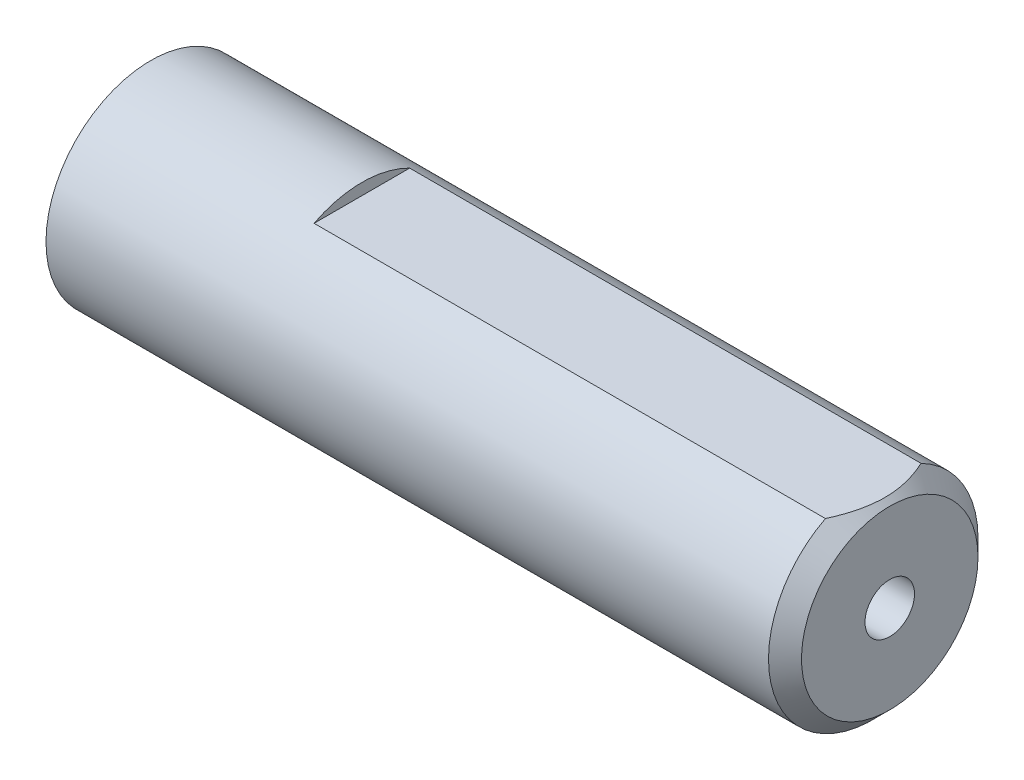
from build123d import *

# Parameters (mm, degrees)
ESBO_O1_R                = 3.175
RESSALTO_EXTRUS_O1_DEPTH = 22.4
CHANFRO1_SIZE            = 0.5
ESBO_O3_W                = 2.89827535
ESBO_O3_H                = 0.35
CORTE_EXTRUS_O1_DEPTH    = 16
ESBO_O4_R                = 0.75
CORTE_EXTRUS_O2_DEPTH    = 3


with BuildPart() as part:
    # Esboço1 → Ressalto-extrusão1 (new body)
    with BuildSketch(Plane(origin=(0, 0, 0), x_dir=(0, 0, -1), z_dir=(1, 0, 0))):
        Circle(ESBO_O1_R)
    extrude(amount=RESSALTO_EXTRUS_O1_DEPTH)

    # Chanfro1
    chanfro1_edges = [part.edges().sort_by_distance(p)[0] for p in [
        (22.4, 0, 3.175),
    ]]
    chamfer(chanfro1_edges, length=CHANFRO1_SIZE)

    # Esboço3 → Corte-extrusão1 (cut)
    with BuildSketch(Plane(origin=(22.4, 0, 0), x_dir=(0, 0, -1), z_dir=(1, 0, 0))):
        with Locations((0, 3)):
            Rectangle(ESBO_O3_W, ESBO_O3_H)
    extrude(amount=-CORTE_EXTRUS_O1_DEPTH, mode=Mode.SUBTRACT)

    # Esboço4 → Corte-extrusão2 (cut)
    with BuildSketch(Plane(origin=(22.4, 0, 0), x_dir=(0, 0, -1), z_dir=(1, 0, 0))):
        Circle(ESBO_O4_R)
    extrude(amount=-CORTE_EXTRUS_O2_DEPTH, mode=Mode.SUBTRACT)


solid = part.part
